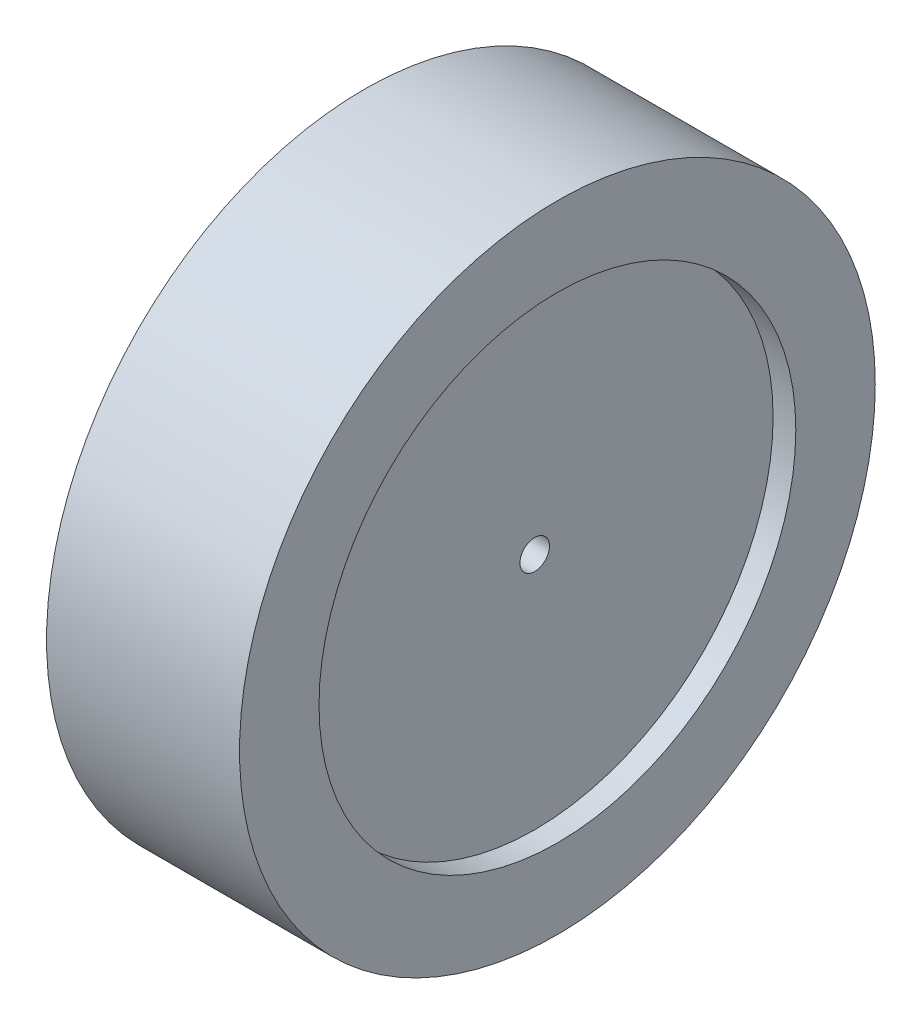
from build123d import *

# Parameters (mm, degrees)
ESQUISSE1_R             = 28
BOSS_EXTRU_1_DEPTH      = 17
ESQUISSE2_R             = 1.3
ENL_V_MAT_EXTRU_1_DEPTH = 17
ESQUISSE3_R             = 21
ENL_V_MAT_EXTRU_2_DEPTH = 2


with BuildPart() as part:
    # Esquisse1 → Boss.-Extru.1 (new body)
    with BuildSketch(Plane(origin=(0, 0, 0), x_dir=(0, 0, -1), z_dir=(1, 0, 0))):
        Circle(ESQUISSE1_R)
    extrude(amount=BOSS_EXTRU_1_DEPTH)

    # Esquisse2 → Enlèv. mat.-Extru.1 (cut)
    with BuildSketch(Plane(origin=(17, 0, 0), x_dir=(0, 0, -1), z_dir=(1, 0, 0))):
        Circle(ESQUISSE2_R)
    extrude(amount=-ENL_V_MAT_EXTRU_1_DEPTH, mode=Mode.SUBTRACT)

    # Esquisse3 → Enlèv. mat.-Extru.2 (cut)
    with BuildSketch(Plane(origin=(17, 0, 0), x_dir=(0, 0, -1), z_dir=(1, 0, 0))):
        Circle(ESQUISSE3_R)
    enl_v_mat_extru_2 = extrude(amount=-ENL_V_MAT_EXTRU_2_DEPTH, mode=Mode.SUBTRACT)

    # Symétrie1: Enlèv. mat.-Extru.2 across plane
    add(enl_v_mat_extru_2.mirror(Plane(origin=(8.5, 0, 0), x_dir=(0, 0, 1), z_dir=(1, 0, 0))), mode=Mode.SUBTRACT)


solid = part.part
